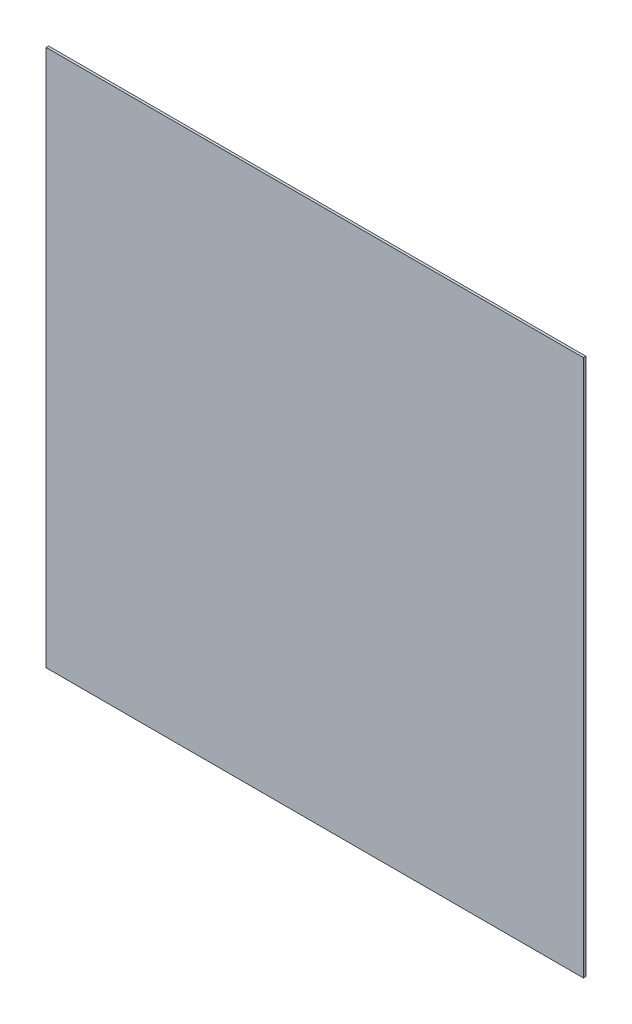
from build123d import *

# Parameters (mm, degrees)
SKETCH1_W           = 22000
SKETCH1_H           = 22000
BOSS_EXTRUDE1_DEPTH = 100


with BuildPart() as part:
    # Sketch1 → Boss-Extrude1 (new body)
    with BuildSketch(Plane.XY):
        Rectangle(SKETCH1_W, SKETCH1_H)
    extrude(amount=BOSS_EXTRUDE1_DEPTH)


solid = part.part
